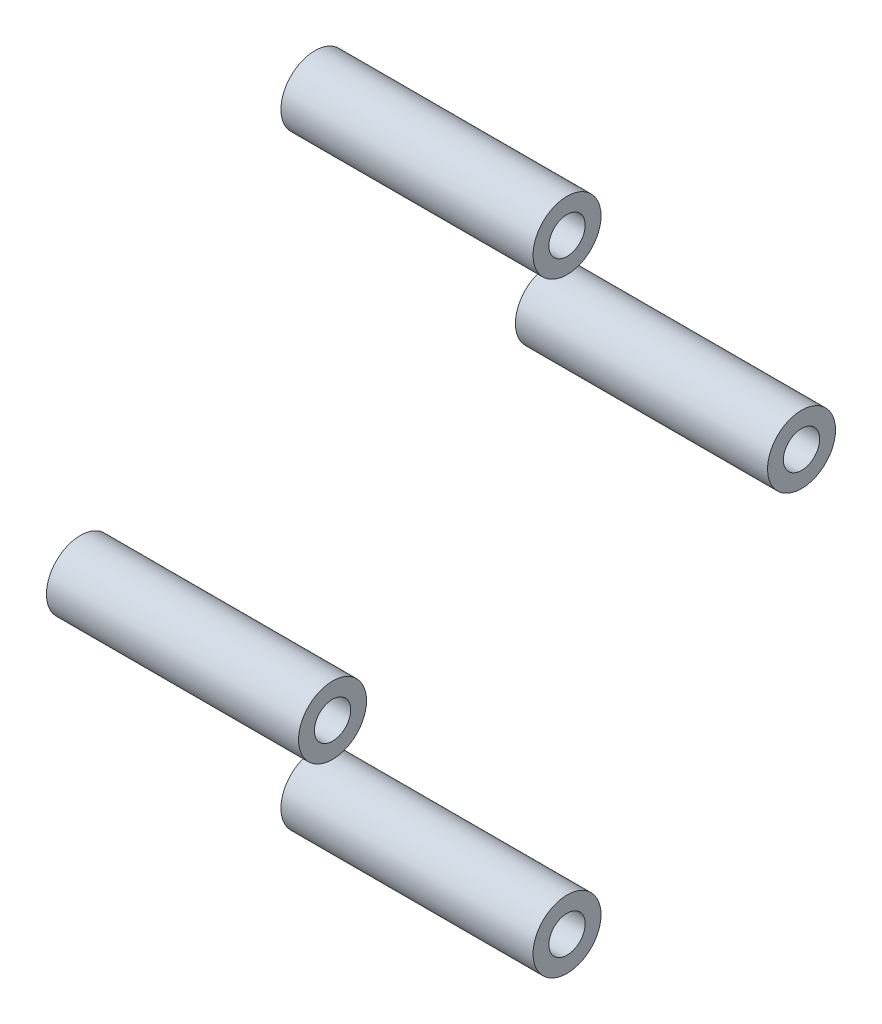
from build123d import *

# Parameters (mm, degrees)
SKETCH3_R             = 3.37
SKETCH3_R_2           = 1.8
BOSS_EXTRUDE1_DEPTH   = 25
BOSS_EXTRUDE1_2_DEPTH = 25
BOSS_EXTRUDE1_3_DEPTH = 25
BOSS_EXTRUDE1_4_DEPTH = 25


with BuildPart() as part:
    # Sketch3 → Boss-Extrude1 (new body)
    with BuildSketch(Plane.YZ):
        with Locations(Location((0, 23.25, 0), (0, 0, 270))):
            Circle(SKETCH3_R)
        with Locations(Location((0, 23.25, 0), (0, 0, 270))):
            Circle(SKETCH3_R_2, mode=Mode.SUBTRACT)
    extrude(amount=BOSS_EXTRUDE1_DEPTH)


with BuildPart() as body_2:
    # Sketch3 → Boss-Extrude1 2 (new body)
    with BuildSketch(Plane.YZ):
        with Locations(Location((30, 0, 0), (0, 0, 270))):
            Circle(SKETCH3_R)
        with Locations(Location((30, 0, 0), (0, 0, 270))):
            Circle(SKETCH3_R_2, mode=Mode.SUBTRACT)
    extrude(amount=BOSS_EXTRUDE1_2_DEPTH)


with BuildPart() as body_3:
    # Sketch3 → Boss-Extrude1 3 (new body)
    with BuildSketch(Plane.YZ):
        with Locations(Location((0, -23.25, 0), (0, 0, 270))):
            Circle(SKETCH3_R)
        with Locations(Location((0, -23.25, 0), (0, 0, 270))):
            Circle(SKETCH3_R_2, mode=Mode.SUBTRACT)
    extrude(amount=BOSS_EXTRUDE1_3_DEPTH)


with BuildPart() as body_4:
    # Sketch3 → Boss-Extrude1 4 (new body)
    with BuildSketch(Plane.YZ):
        with Locations(Location((-30, 0, 0), (0, 0, 270))):
            Circle(SKETCH3_R)
        with Locations(Location((-30, 0, 0), (0, 0, 270))):
            Circle(SKETCH3_R_2, mode=Mode.SUBTRACT)
    extrude(amount=BOSS_EXTRUDE1_4_DEPTH)


solid = Compound([part.part, body_2.part, body_3.part, body_4.part])
